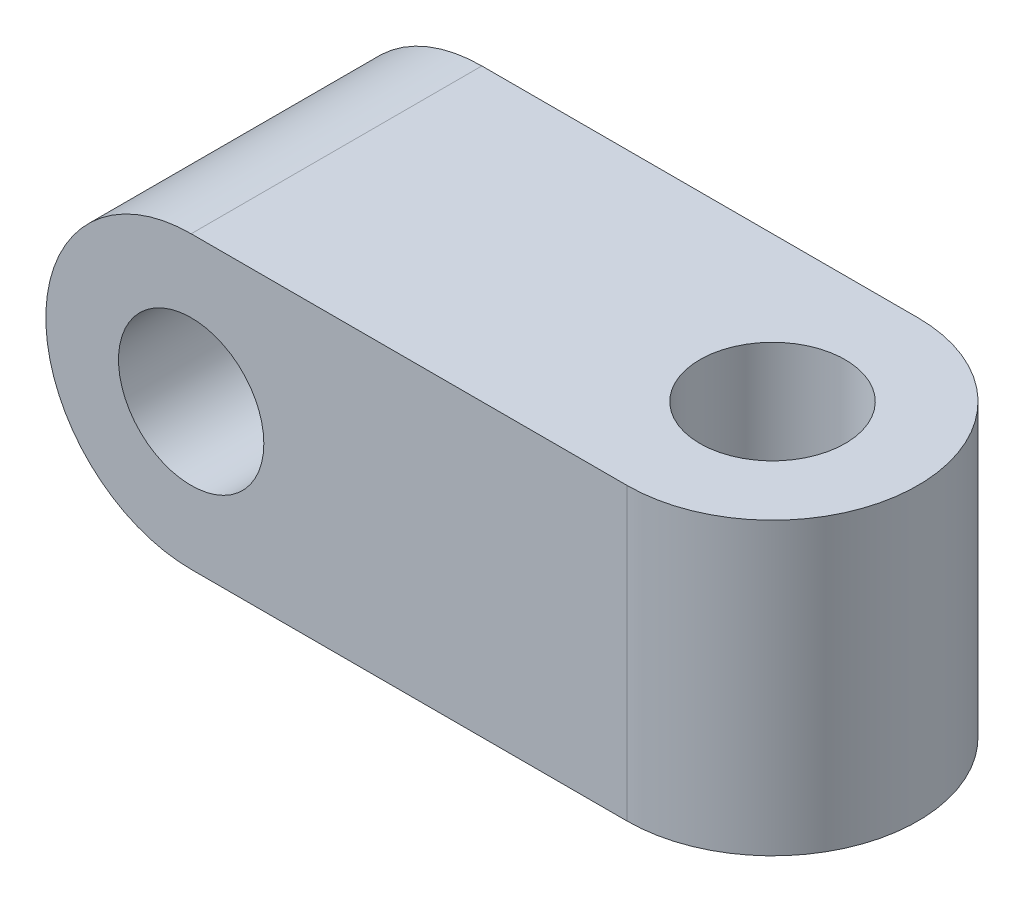
from build123d import *

# Parameters (mm, degrees)
SKETCH1_R           = 2
BOSS_EXTRUDE1_DEPTH = 4
BOSS_EXTRUDE2_START = -4
BOSS_EXTRUDE2_DEPTH = 4
SKETCH3_R           = 1
CUT_EXTRUDE1_DEPTH  = 6.385164807
SKETCH7_R           = 1
BOSS_EXTRUDE4_DEPTH = 2


with BuildPart() as part:
    # Sketch1 → Boss-Extrude1 (new body)
    with BuildSketch(Plane.XY):
        Circle(SKETCH1_R)
    extrude(amount=BOSS_EXTRUDE1_DEPTH)

    # Sketch2 → Boss-Extrude2 (add)
    with BuildSketch(Plane.XY.offset(4).offset(BOSS_EXTRUDE2_START)):
        with BuildLine():
            Line((3, 2), (0, 2))
            ThreePointArc((0, 2), (1.414213562, 1.414213562), (2, 0))
            ThreePointArc((2, 0), (1.414213562, -1.414213562), (0, -2))
            Line((0, -2), (3, -2))
            Line((3, -2), (3, 2))
        make_face()
    extrude(amount=BOSS_EXTRUDE2_DEPTH)

    # Sketch3 → Cut-Extrude1 (cut, through all)
    with BuildSketch(Plane.XY.offset(4)):
        Circle(SKETCH3_R)
    extrude(amount=-CUT_EXTRUDE1_DEPTH, mode=Mode.SUBTRACT)

    # Sketch7 → Boss-Extrude4 (add, symmetric)
    with BuildSketch(Plane(origin=(0, 0, 0), x_dir=(1, 0, 0), z_dir=(0, 1, 0))):
        with BuildLine():
            Line((3, 0), (3, -4))
            Line((3, -4), (6, -4))
            ThreePointArc((6, -4), (8, -2), (6, 0))
            Line((6, 0), (3, 0))
        make_face()
        with Locations(Location((6, -2, 0), (0, 0, 270))):
            Circle(SKETCH7_R, mode=Mode.SUBTRACT)
    extrude(amount=BOSS_EXTRUDE4_DEPTH, both=True)


solid = part.part
